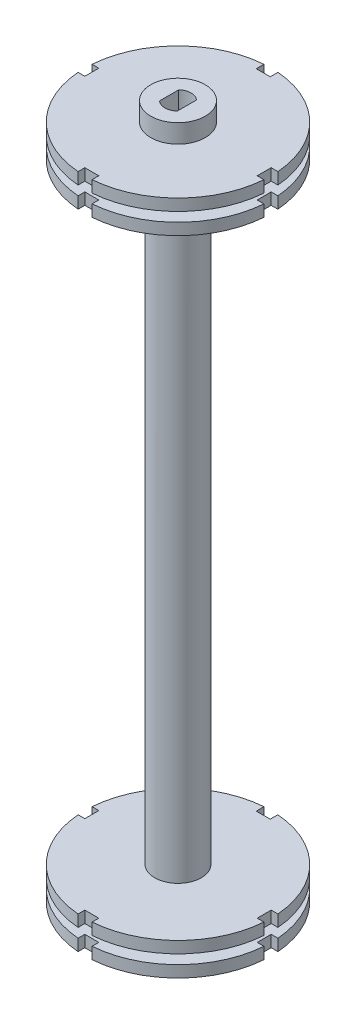
from build123d import *

# Parameters (mm, degrees)
BOSS_EXTRUDE1_DEPTH     = 6.5
SKETCH2_R               = 20
BOSS_EXTRUDE2_DEPTH     = 2.5
CUT_EXTRUDE1_DEPTH      = 8
SKETCH4_W               = 3
SKETCH4_H               = 3
CUT_EXTRUDE2_DEPTH      = 10
SKETCH5_R               = 5
BOSS_EXTRUDE3_DEPTH     = 140
CUT_EXTRUDE3_DEPTH      = 10
MIRROR5_COPY_1_SKETCH_R = 20
MIRROR5_COPY_1_DEPTH    = 2.5
MIRROR5_COPY_2_SKETCH_W = 3
MIRROR5_COPY_2_SKETCH_H = 3
MIRROR5_COPY_2_DEPTH    = 10


with BuildPart() as part:
    # Sketch1 → Boss-Extrude1 (new body)
    with BuildSketch(Plane(origin=(0, 0, 0), x_dir=(1, 0, 0), z_dir=(0, 1, 0))):
        with BuildLine():
            ThreePointArc((-1.9, -2.05669638), (-2.8, 0), (-1.9, 2.05669638))
            Line((-1.9, 2.05669638), (-1.9, 5.532856405))
            ThreePointArc((-1.9, 5.532856405), (-5.85, 0), (-1.9, -5.532856405))
            Line((-1.9, -5.532856405), (-1.9, -2.05669638))
        make_face()
        with BuildLine():
            ThreePointArc((-1.9, 2.05669638), (0, 2.8), (1.9, 2.05669638))
            Line((1.9, 2.05669638), (1.9, 5.532856405))
            ThreePointArc((1.9, 5.532856405), (0, 5.85), (-1.9, 5.532856405))
            Line((-1.9, 5.532856405), (-1.9, 2.05669638))
        make_face()
        with BuildLine():
            Line((1.9, 5.532856405), (1.9, 2.05669638))
            ThreePointArc((1.9, 2.05669638), (2.565151068, 1.122497216), (2.8, 0))
            ThreePointArc((2.8, 0), (2.565151068, -1.122497216), (1.9, -2.05669638))
            Line((1.9, -2.05669638), (1.9, -5.532856405))
            ThreePointArc((1.9, -5.532856405), (4.761171074, -3.399080758), (5.85, 0))
            ThreePointArc((5.85, 0), (4.761171074, 3.399080758), (1.9, 5.532856405))
        make_face()
        with BuildLine():
            Line((1.9, -5.532856405), (1.9, -2.05669638))
            ThreePointArc((1.9, -2.05669638), (0, -2.8), (-1.9, -2.05669638))
            Line((-1.9, -2.05669638), (-1.9, -5.532856405))
            ThreePointArc((-1.9, -5.532856405), (0, -5.85), (1.9, -5.532856405))
        make_face()
        with BuildLine():
            Line((-1.9, -2.05669638), (-1.9, 2.05669638))
            ThreePointArc((-1.9, 2.05669638), (-2.8, 0), (-1.9, -2.05669638))
        make_face()
        with BuildLine():
            ThreePointArc((2.8, 0), (2.565151068, 1.122497216), (1.9, 2.05669638))
            Line((1.9, 2.05669638), (1.9, -2.05669638))
            ThreePointArc((1.9, -2.05669638), (2.565151068, -1.122497216), (2.8, 0))
        make_face()
    boss_extrude1 = extrude(amount=BOSS_EXTRUDE1_DEPTH)

    # Sketch2 → Boss-Extrude2 (add)
    with BuildSketch(Plane(origin=(0, 6.5, 0), x_dir=(1, 0, 0), z_dir=(0, 1, 0))):
        with Locations(Location((0, 0, 0), (0, 0, 270))):
            Circle(SKETCH2_R)
    boss_extrude2 = extrude(amount=-BOSS_EXTRUDE2_DEPTH)

    # Sketch3 → Cut-Extrude1 (cut)
    with BuildSketch(Plane.XZ.offset(-4)):
        with BuildLine():
            Line((-1.9, 2.05669638), (-1.9, -2.05669638))
            ThreePointArc((-1.9, -2.05669638), (0, -2.8), (1.9, -2.05669638))
            Line((1.9, -2.05669638), (1.9, 2.05669638))
            ThreePointArc((1.9, 2.05669638), (0, 2.8), (-1.9, 2.05669638))
        make_face()
    extrude(amount=-CUT_EXTRUDE1_DEPTH, mode=Mode.SUBTRACT)

    # Sketch4 → Cut-Extrude2 (cut)
    with BuildSketch(Plane(origin=(0, 6.5, 0), x_dir=(1, 0, 0), z_dir=(0, 1, 0))):
        with Locations((0, 19.8)):
            Rectangle(SKETCH4_W, SKETCH4_H)
        with Locations((20, 0)):
            Rectangle(SKETCH4_W, SKETCH4_H)
        with Locations((0, -20)):
            Rectangle(SKETCH4_W, SKETCH4_H)
        with Locations((-20, 0)):
            Rectangle(SKETCH4_W, SKETCH4_H)
    cut_extrude2 = extrude(amount=-CUT_EXTRUDE2_DEPTH, mode=Mode.SUBTRACT)

    # Sketch5 → Boss-Extrude3 (add)
    with BuildSketch(Plane(origin=(0, 6.5, 0), x_dir=(1, 0, 0), z_dir=(0, 1, 0))):
        with Locations(Location((0, 0, 0), (0, 0, 270))):
            Circle(SKETCH5_R)
    extrude(amount=BOSS_EXTRUDE3_DEPTH)

    # Mirror1: Boss-Extrude2, Cut-Extrude2 across plane
    add(boss_extrude2.mirror(Plane.ZX.offset(76.5)))
    add(cut_extrude2.mirror(Plane.ZX.offset(76.5)), mode=Mode.SUBTRACT)

    # Mirror2: Boss-Extrude1 across plane
    add(boss_extrude1.mirror(Plane.ZX.offset(76.5)))

    # Sketch6 → Cut-Extrude3 (cut)
    with BuildSketch(Plane.XZ.offset(-6.5)):
        with BuildLine():
            Line((-1.9, 2.05669638), (-1.9, -2.05669638))
            ThreePointArc((-1.9, -2.05669638), (0, -2.8), (1.9, -2.05669638))
            Line((1.9, -2.05669638), (1.9, 2.05669638))
            ThreePointArc((1.9, 2.05669638), (0, 2.8), (-1.9, 2.05669638))
        make_face()
    extrude(amount=-CUT_EXTRUDE3_DEPTH, mode=Mode.SUBTRACT)

    # Mirror3: Boss-Extrude2, Cut-Extrude2 across plane
    add(boss_extrude2.mirror(Plane.ZX.offset(7.5)))
    add(cut_extrude2.mirror(Plane.ZX.offset(7.5)), mode=Mode.SUBTRACT)

    # Mirror5 copy 1 sketch → Mirror5 copy 1 (add)
    with BuildSketch(Plane(origin=(0, 144.5, 0), x_dir=(1, 0, 0), z_dir=(0, 1, 0))):
        with Locations(Location((0, 0, 0), (0, 0, 270))):
            Circle(MIRROR5_COPY_1_SKETCH_R)
    extrude(amount=-MIRROR5_COPY_1_DEPTH)

    # Mirror5 copy 2 sketch → Mirror5 copy 2 (cut)
    with BuildSketch(Plane(origin=(0, 144.5, 0), x_dir=(1, 0, 0), z_dir=(0, 1, 0))):
        with Locations((0, 19.8)):
            Rectangle(MIRROR5_COPY_2_SKETCH_W, MIRROR5_COPY_2_SKETCH_H)
        with Locations((20, 0)):
            Rectangle(MIRROR5_COPY_2_SKETCH_W, MIRROR5_COPY_2_SKETCH_H)
        with Locations((0, -20)):
            Rectangle(MIRROR5_COPY_2_SKETCH_W, MIRROR5_COPY_2_SKETCH_H)
        with Locations((-20, 0)):
            Rectangle(MIRROR5_COPY_2_SKETCH_W, MIRROR5_COPY_2_SKETCH_H)
    extrude(amount=-MIRROR5_COPY_2_DEPTH, mode=Mode.SUBTRACT)


solid = part.part
